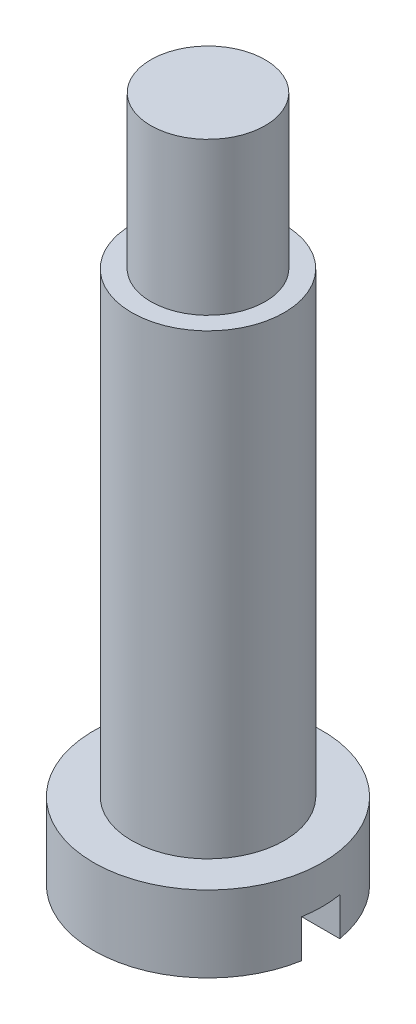
from build123d import *

# Parameters (mm, degrees)
SKETCH_1_R               = 3
EXTRUDE_1_DEPTH          = 2
SKETCH_2_R               = 2
EXTRUDE_2_DEPTH          = 12
SKETCH_3_R               = 1.5
EXTRUDE_3_DEPTH          = 4
CUT_EXTRUDE_1_DEPTH      = 19.493242009
CUT_EXTRUDE_1_DEPTH_BACK = 1
SKETCH_4_W               = 6
SKETCH_4_H               = 1


with BuildPart() as part:
    # 草图1 → 凸台-拉伸1 (new body)
    with BuildSketch(Plane(origin=(0, 0, 0), x_dir=(1, 0, 0), z_dir=(0, 1, 0))):
        Circle(SKETCH_1_R)
    extrude(amount=-EXTRUDE_1_DEPTH)

    # 草图2 → 凸台-拉伸2 (add)
    with BuildSketch(Plane(origin=(0, 0, 0), x_dir=(1, 0, 0), z_dir=(0, 1, 0))):
        Circle(SKETCH_2_R)
    extrude(amount=EXTRUDE_2_DEPTH)

    # 草图3 → 凸台-拉伸3 (add)
    with BuildSketch(Plane(origin=(0, 12, 0), x_dir=(1, 0, 0), z_dir=(0, 1, 0))):
        Circle(SKETCH_3_R)
    extrude(amount=EXTRUDE_3_DEPTH)

    # 草图4 → 切除-拉伸-薄壁1 (cut, two sides: drawn at the far end of the back side and taken through both)
    with BuildSketch(Plane.XZ.offset(2).offset(-CUT_EXTRUDE_1_DEPTH_BACK)):
        Rectangle(SKETCH_4_W, SKETCH_4_H)
    extrude(amount=CUT_EXTRUDE_1_DEPTH + CUT_EXTRUDE_1_DEPTH_BACK, mode=Mode.SUBTRACT)


solid = part.part
